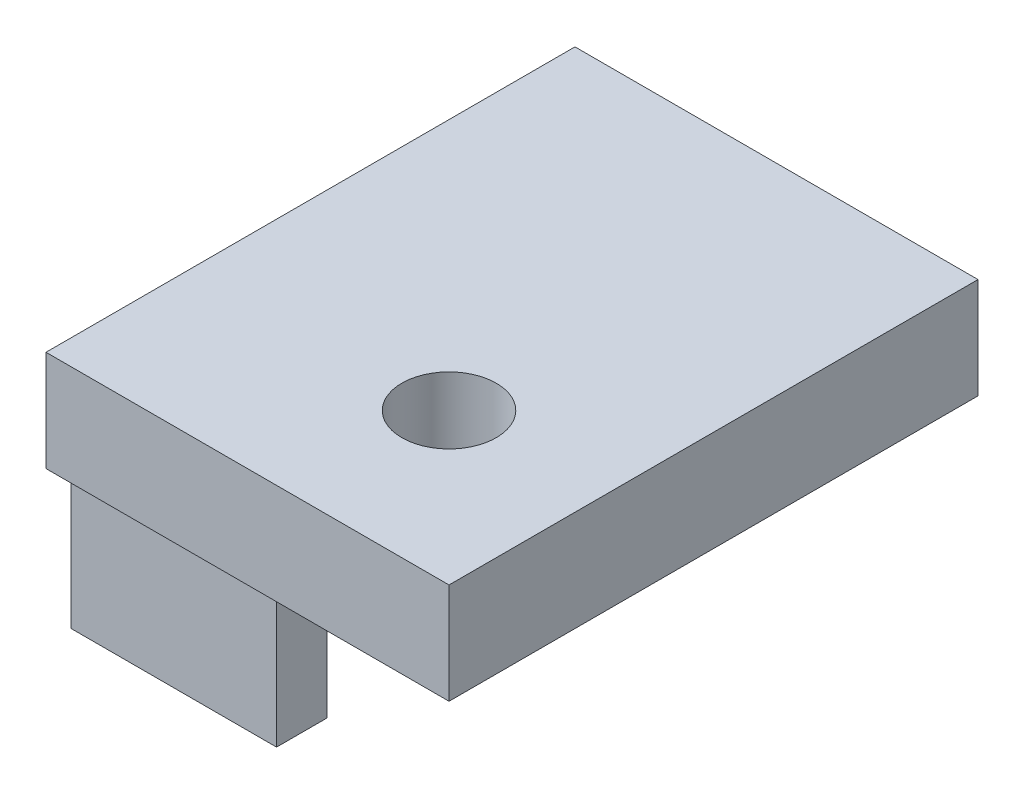
from build123d import *

# Parameters (mm, degrees)
SKETCH1_W           = 9.6
SKETCH1_H           = 16.8
SKETCH1_R           = 1.5
BOSS_EXTRUDE1_DEPTH = 3.2
SKETCH3_W           = 16.8
SKETCH3_H           = 3.2
BOSS_EXTRUDE2_DEPTH = 3.2
SKETCH4_W           = 6.522228594
SKETCH4_H           = 1.6
BOSS_EXTRUDE3_DEPTH = 4.8
SKETCH5_W           = 6.289556992
SKETCH5_H           = 1.6
BOSS_EXTRUDE4_DEPTH = 4.8


with BuildPart() as part:
    # Sketch1 → Boss-Extrude1 (new body)
    with BuildSketch(Plane(origin=(0, 0, 0), x_dir=(1, 0, 0), z_dir=(0, 1, 0))):
        with Locations((4.8, -8.4)):
            Rectangle(SKETCH1_W, SKETCH1_H)
        with Locations(Location((4.8, -12, 0), (0, 0, 270))):
            Circle(SKETCH1_R, mode=Mode.SUBTRACT)
    extrude(amount=BOSS_EXTRUDE1_DEPTH)

    # Sketch3 → Boss-Extrude2 (add)
    with BuildSketch(Plane.ZY):
        with Locations((8.4, 1.6)):
            Rectangle(SKETCH3_W, SKETCH3_H)
    extrude(amount=BOSS_EXTRUDE2_DEPTH)

    # Sketch4 → Boss-Extrude3 (add)
    with BuildSketch(Plane(origin=(0, 0, 0), x_dir=(-1, 0, 0), z_dir=(0, -1, 0))):
        with Locations((-0.061114297, -15.2)):
            Rectangle(SKETCH4_W, SKETCH4_H)
    extrude(amount=BOSS_EXTRUDE3_DEPTH)

    # Sketch5 → Boss-Extrude4 (add)
    with BuildSketch(Plane(origin=(0, 0, 0), x_dir=(-1, 0, 0), z_dir=(0, -1, 0))):
        with Locations((0.055221504, -0.8)):
            Rectangle(SKETCH5_W, SKETCH5_H)
    extrude(amount=BOSS_EXTRUDE4_DEPTH)


solid = part.part
